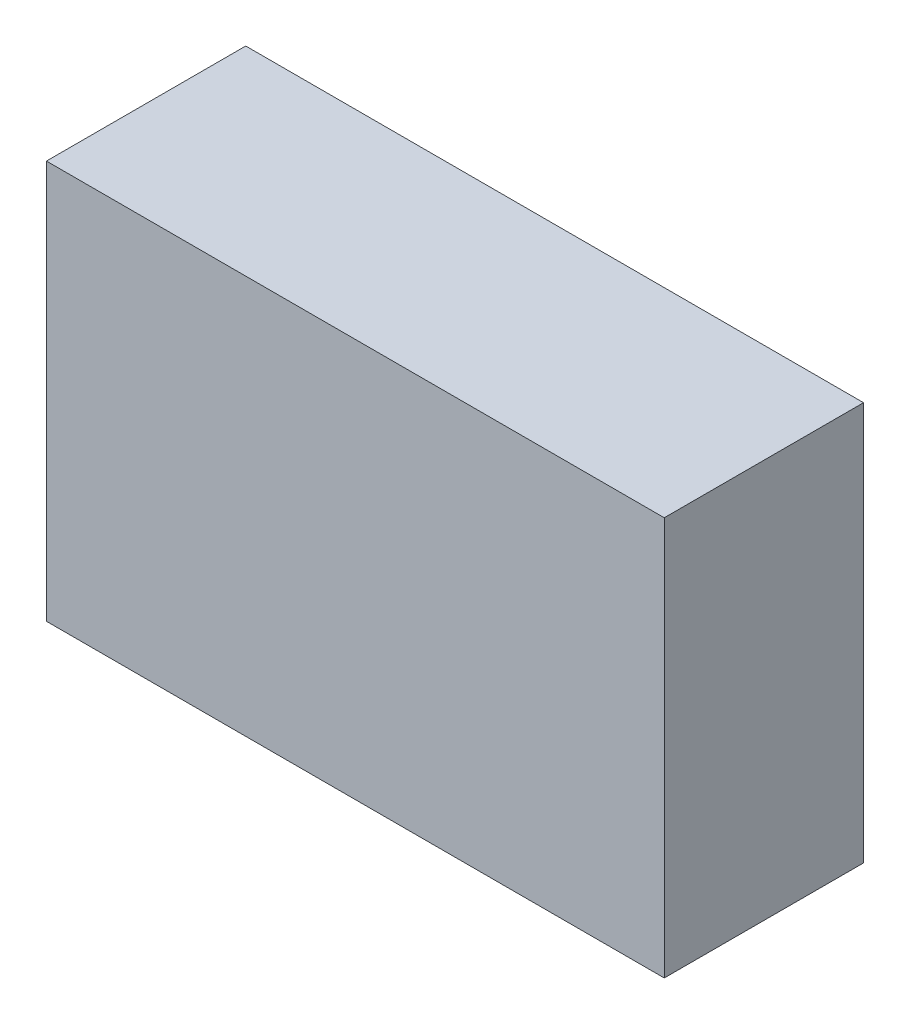
from build123d import *

# Parameters (mm, degrees)
SKETCH1_W           = 31
SKETCH1_H           = 20
BOSS_EXTRUDE1_DEPTH = 10


with BuildPart() as part:
    # Sketch1 → Boss-Extrude1 (new body)
    with BuildSketch(Plane.XY):
        with Locations((15.5, 10)):
            Rectangle(SKETCH1_W, SKETCH1_H)
    extrude(amount=-BOSS_EXTRUDE1_DEPTH)


solid = part.part
